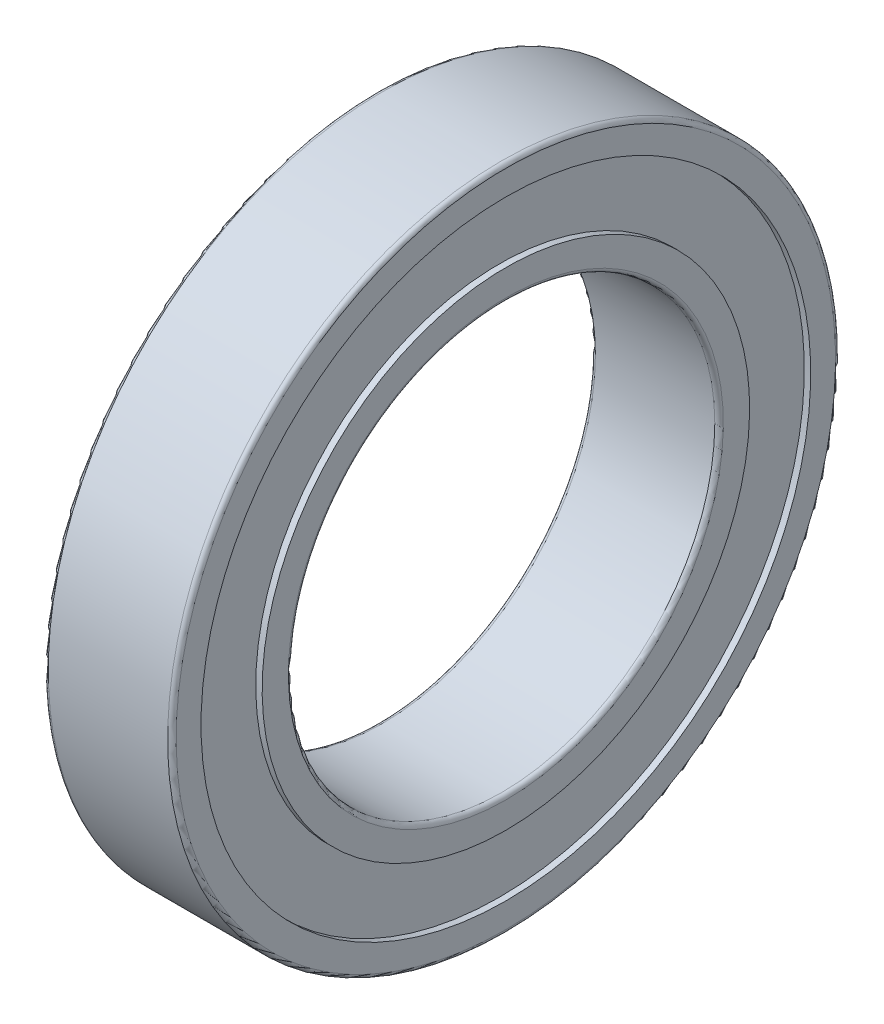
from build123d import *

# Parameters (mm, degrees)
FILLET1_R = 0.3


with BuildPart() as part:
    # Sketch1 → Revolve1 (revolve)
    with BuildSketch(Plane.XY, mode=Mode.PRIVATE) as revolve1_sk:
        Polygon((0, 15), (0, 17.15), (0.45, 17.15), (0.45, 21.45), (0, 21.45), (0, 23.5), (9, 23.5), (9, 21.45), (8.55, 21.45), (8.55, 17.15), (9, 17.15), (9, 15), align=None)
    revolve(revolve1_sk.sketch.rotate(Axis((0, 0, 0), (1, 0, 0)), 180), axis=Axis((0, 0, 0), (1, 0, 0)))

    # Fillet1
    fillet1_edges = [part.edges().sort_by_distance(p)[0] for p in [
        (9, 23.5, 0),
        (0, 23.5, 0),
        (0, 15, 0),
        (9, 15, 0),
    ]]
    fillet(fillet1_edges, radius=FILLET1_R)


solid = part.part
